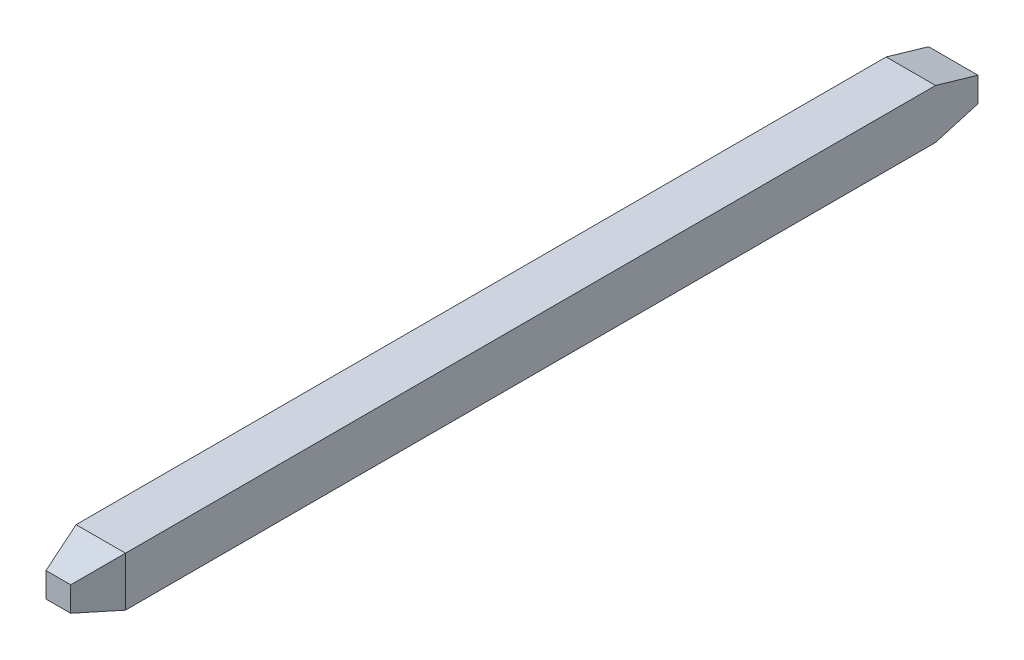
from build123d import *

# Parameters (mm, degrees)
EXTRUDE_1_DEPTH      = 0.32
EXTRUDE_1_DEPTH_BACK = 0.32
CUT_EXTRUDE_2_DEPTH  = 6.843971252


with BuildPart() as part:
    # Эскиз1 → Бобышка-Вытянуть1 (new, two sides: drawn at the far end of the back side and taken through both)
    with BuildSketch(Plane(origin=(0, 0, 0), x_dir=(0, 0, -1), z_dir=(1, 0, 0)).offset(-EXTRUDE_1_DEPTH_BACK)):
        Polygon((-5.25, -0.32), (5.25, -0.32), (5.8, -0.16), (5.8, 0.16), (5.25, 0.32), (-5.25, 0.32), (-5.8, 0.16), (-5.8, -0.16), align=None)
    extrude(amount=EXTRUDE_1_DEPTH + EXTRUDE_1_DEPTH_BACK)

    # Эскиз4 → Вырез-Вытянуть2 (cut, through all)
    with BuildSketch(Plane.XZ.offset(0.32)):
        Polygon((-0.32, 5.25), (-0.16, 5.8), (-0.32, 5.8), align=None)
    cut_extrude_2 = extrude(amount=-CUT_EXTRUDE_2_DEPTH, mode=Mode.SUBTRACT)

    # Зеркальное отражение1: Вырез-Вытянуть2 across plane
    add(cut_extrude_2.mirror(Plane(origin=(0, 0, 0), x_dir=(0, 0, 1), z_dir=(1, 0, 0))), mode=Mode.SUBTRACT)


solid = part.part
